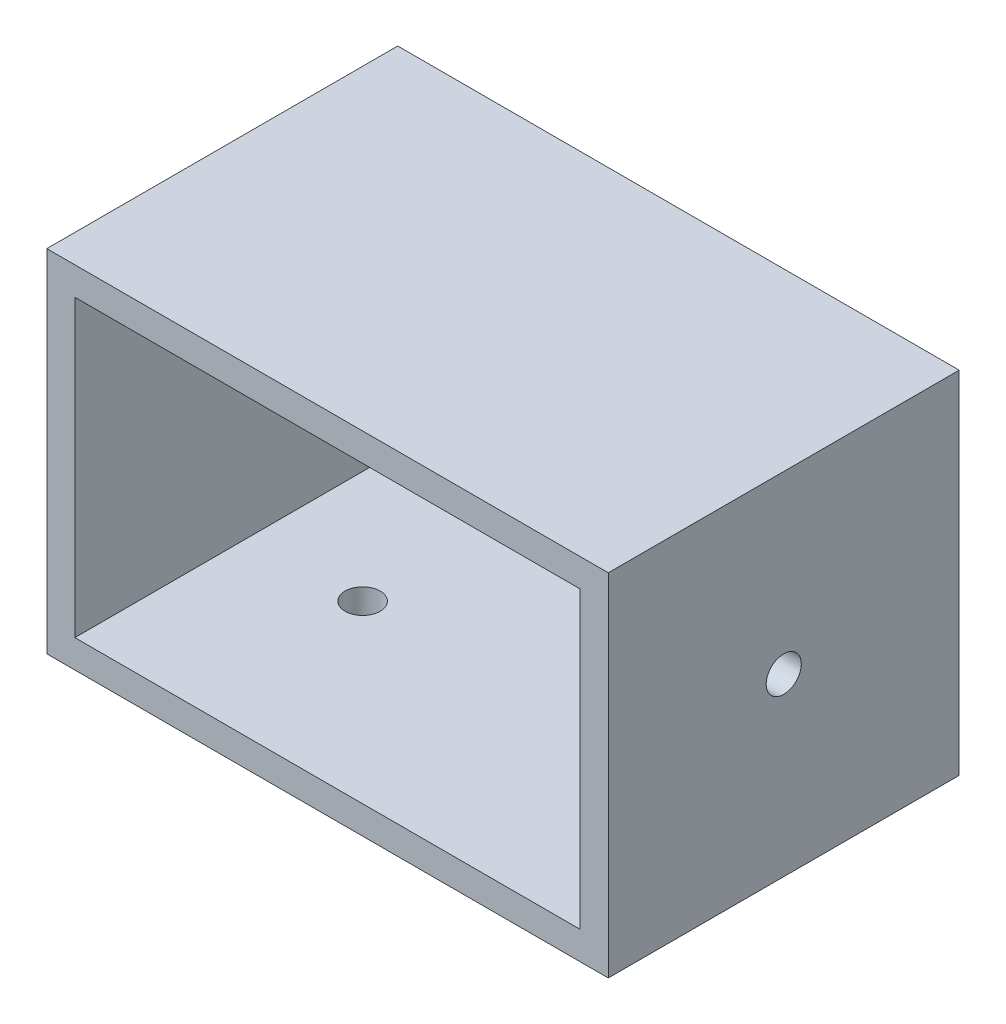
from build123d import *

# Parameters (mm, degrees)
SKETCH1_W           = 160
SKETCH1_H           = 100
SKETCH1_W_2         = 144
SKETCH1_H_2         = 84
BOSS_EXTRUDE1_DEPTH = 100
SKETCH2_R           = 5
CUT_EXTRUDE1_DEPTH  = 10
SKETCH3_R           = 5
CUT_EXTRUDE2_DEPTH  = 10


with BuildPart() as part:
    # Sketch1 → Boss-Extrude1 (new body)
    with BuildSketch(Plane.XY):
        with Locations((80, -50)):
            Rectangle(SKETCH1_W, SKETCH1_H)
        with Locations((80, -50)):
            Rectangle(SKETCH1_W_2, SKETCH1_H_2, mode=Mode.SUBTRACT)
    extrude(amount=BOSS_EXTRUDE1_DEPTH)

    # Sketch2 → Cut-Extrude1 (cut)
    with BuildSketch(Plane.XZ.offset(100)):
        with Locations(Location((40, 50, 0), (0, 0, 270))):
            Circle(SKETCH2_R)
    extrude(amount=-CUT_EXTRUDE1_DEPTH, mode=Mode.SUBTRACT)

    # Sketch3 → Cut-Extrude2 (cut)
    with BuildSketch(Plane(origin=(160, 0, 0), x_dir=(0, 0, -1), z_dir=(1, 0, 0))):
        with Locations(Location((-50, -50, 0), (0, 0, 90))):
            Circle(SKETCH3_R)
    extrude(amount=-CUT_EXTRUDE2_DEPTH, mode=Mode.SUBTRACT)


solid = part.part
